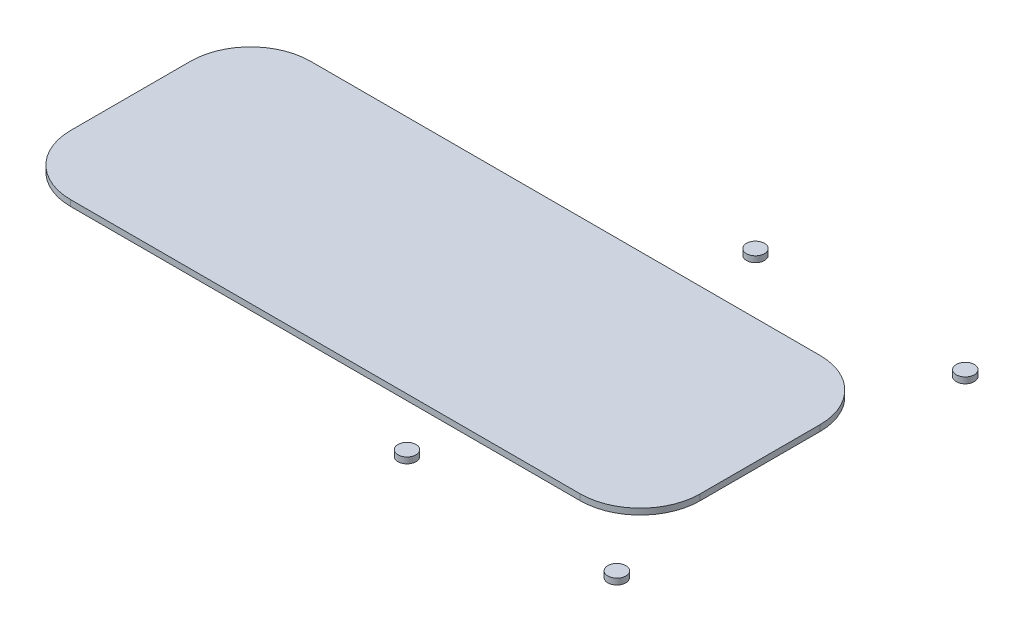
from build123d import *

# Parameters (mm, degrees)
SKETCH1_W             = 266.7
SKETCH1_H             = 101.6
BOSS_EXTRUDE1_DEPTH   = 2.54
SKETCH3_R             = 3.81
BOSS_EXTRUDE2_DEPTH   = 2.54
BOSS_EXTRUDE2_2_DEPTH = 2.54
BOSS_EXTRUDE2_3_DEPTH = 2.54
BOSS_EXTRUDE2_4_DEPTH = 2.54
FILLET1_R             = 25.4


with BuildPart() as part:
    # Sketch1 → Boss-Extrude1 (new body)
    with BuildSketch(Plane(origin=(0, 0, 0), x_dir=(1, 0, 0), z_dir=(0, 1, 0))):
        with Locations((133.35, 50.8)):
            Rectangle(SKETCH1_W, SKETCH1_H)
    extrude(amount=BOSS_EXTRUDE1_DEPTH)

    # Fillet1
    fillet1_edges = [part.edges().sort_by_distance(p)[0] for p in [
        (0, 1.27, -101.6),
        (266.7, 1.27, -101.6),
        (266.7, 1.27, 0),
        (0, 1.27, 0),
    ]]
    fillet(fillet1_edges, radius=FILLET1_R)


with BuildPart() as body_2:
    # Sketch3 → Boss-Extrude2 (new body)
    with BuildSketch(Plane(origin=(0, 2.54, 0), x_dir=(1, 0, 0), z_dir=(0, 1, 0))):
        with Locations(Location((190.917305237, 124.61875, 0), (0, 0, 270))):
            Circle(SKETCH3_R)
    extrude(amount=BOSS_EXTRUDE2_DEPTH)


with BuildPart() as body_3:
    # Sketch3 → Boss-Extrude2 2 (new body)
    with BuildSketch(Plane(origin=(0, 2.54, 0), x_dir=(1, 0, 0), z_dir=(0, 1, 0))):
        with Locations(Location((279.817305237, 124.61875, 0), (0, 0, 270))):
            Circle(SKETCH3_R)
    extrude(amount=BOSS_EXTRUDE2_2_DEPTH)


with BuildPart() as body_4:
    # Sketch3 → Boss-Extrude2 3 (new body)
    with BuildSketch(Plane(origin=(0, 2.54, 0), x_dir=(1, 0, 0), z_dir=(0, 1, 0))):
        with Locations(Location((279.817305237, -23.01875, 0), (0, 0, 270))):
            Circle(SKETCH3_R)
    extrude(amount=BOSS_EXTRUDE2_3_DEPTH)


with BuildPart() as body_5:
    # Sketch3 → Boss-Extrude2 4 (new body)
    with BuildSketch(Plane(origin=(0, 2.54, 0), x_dir=(1, 0, 0), z_dir=(0, 1, 0))):
        with Locations(Location((190.917305237, -23.01875, 0), (0, 0, 270))):
            Circle(SKETCH3_R)
    extrude(amount=BOSS_EXTRUDE2_4_DEPTH)


solid = Compound([part.part, body_2.part, body_3.part, body_4.part, body_5.part])
